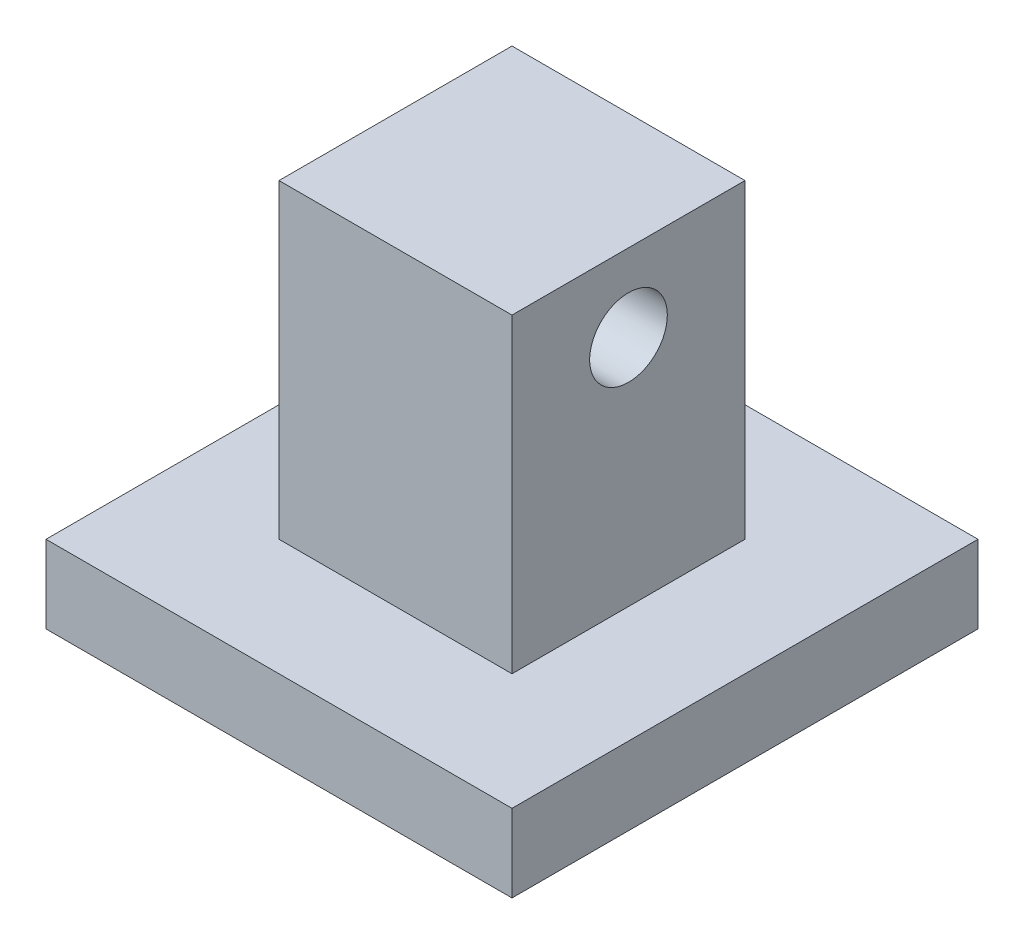
from build123d import *

# Parameters (mm, degrees)
SKETCH1_W           = 152.4
SKETCH1_H           = 152.4
BOSS_EXTRUDE1_DEPTH = 25.4
SKETCH2_W           = 76.2
SKETCH2_H           = 76.2
BOSS_EXTRUDE2_DEPTH = 101.6
CUT_EXTRUDE1_REACH  = 189.083
SKETCH3_R           = 12.7


with BuildPart() as part:
    # Sketch1 → Boss-Extrude1 (new body)
    with BuildSketch(Plane(origin=(0, 0, 0), x_dir=(1, 0, 0), z_dir=(0, 1, 0))):
        Rectangle(SKETCH1_W, SKETCH1_H)
    extrude(amount=BOSS_EXTRUDE1_DEPTH)

    # Sketch2 → Boss-Extrude2 (add)
    with BuildSketch(Plane(origin=(0, 25.4, 0), x_dir=(1, 0, 0), z_dir=(0, 1, 0))):
        Rectangle(SKETCH2_W, SKETCH2_H)
    extrude(amount=BOSS_EXTRUDE2_DEPTH)

    # Sketch3 → Cut-Extrude1 (cut, up to next)
    with BuildSketch(Plane(origin=(38.1, 0, 0), x_dir=(0, 0, -1), z_dir=(1, 0, 0)), mode=Mode.PRIVATE) as cut_extrude1_sk1:
        with Locations((0, 101.6)):
            Circle(SKETCH3_R)
    cut_extrude1_tool1 = extrude(cut_extrude1_sk1.sketch, amount=-CUT_EXTRUDE1_REACH, mode=Mode.PRIVATE) & part.part
    add(cut_extrude1_tool1.solids().sort_by_distance((38.1, 101.6, 0))[0], mode=Mode.SUBTRACT)


solid = part.part
